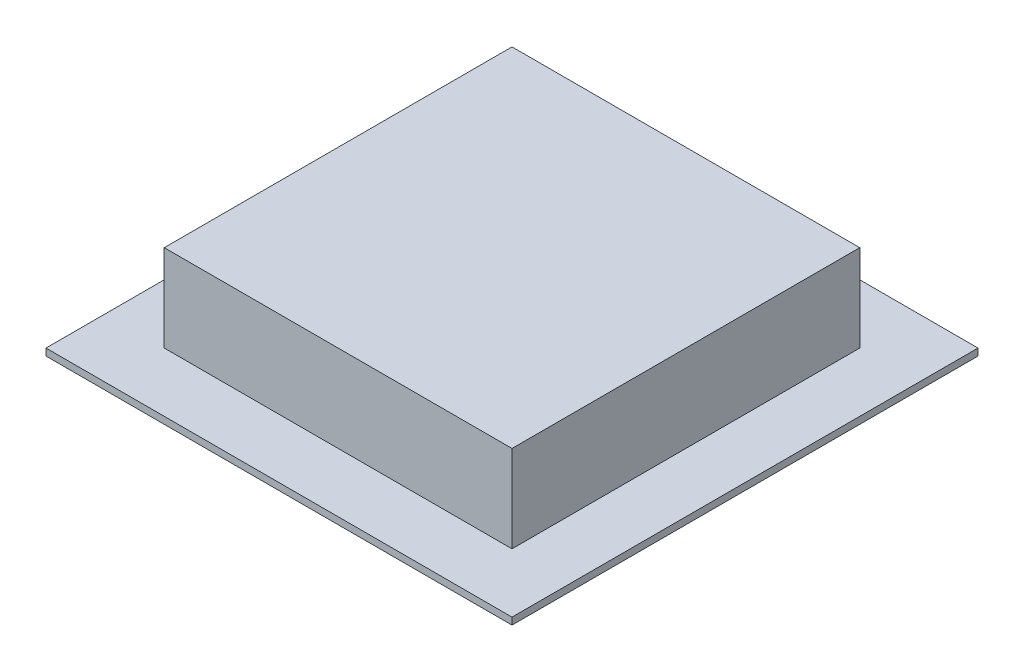
from build123d import *

# Parameters (mm, degrees)
SKETCH1_W                 = 170.18
SKETCH1_H                 = 170.18
BOSS_EXTRUDE1_DEPTH       = 2.54
SKETCH2_W                 = 127
SKETCH2_H                 = 127
BOSS_EXTRUDE2_DEPTH       = 31.75
F_4_0MM_DOWEL_HOLE1_D     = 4
F_4_0MM_DOWEL_HOLE1_DEPTH = 12.7
F_4_0MM_DOWEL_HOLE1_TIP   = 1.201721238


with BuildPart() as part:
    # Sketch1 → Boss-Extrude1 (new body)
    with BuildSketch(Plane(origin=(0, 0, 0), x_dir=(1, 0, 0), z_dir=(0, 1, 0))):
        Rectangle(SKETCH1_W, SKETCH1_H)
    extrude(amount=BOSS_EXTRUDE1_DEPTH)

    # Sketch2 → Boss-Extrude2 (add)
    with BuildSketch(Plane(origin=(0, 2.54, 0), x_dir=(1, 0, 0), z_dir=(0, 1, 0))):
        Rectangle(SKETCH2_W, SKETCH2_H)
    extrude(amount=BOSS_EXTRUDE2_DEPTH)

    # Ø4.0mm Dowel Hole1
    with Locations(Plane(origin=(0, 2.54, 0), x_dir=(1, 0, 0), z_dir=(0, 1, 0))):
        with Locations((-80.01, 78.74)):
            Hole(F_4_0MM_DOWEL_HOLE1_D / 2, depth=F_4_0MM_DOWEL_HOLE1_DEPTH)
            with Locations((0, 0, -(F_4_0MM_DOWEL_HOLE1_DEPTH + F_4_0MM_DOWEL_HOLE1_TIP / 2))):  # 118° drill point
                Cone(0, F_4_0MM_DOWEL_HOLE1_D / 2, F_4_0MM_DOWEL_HOLE1_TIP, mode=Mode.SUBTRACT)


solid = part.part
